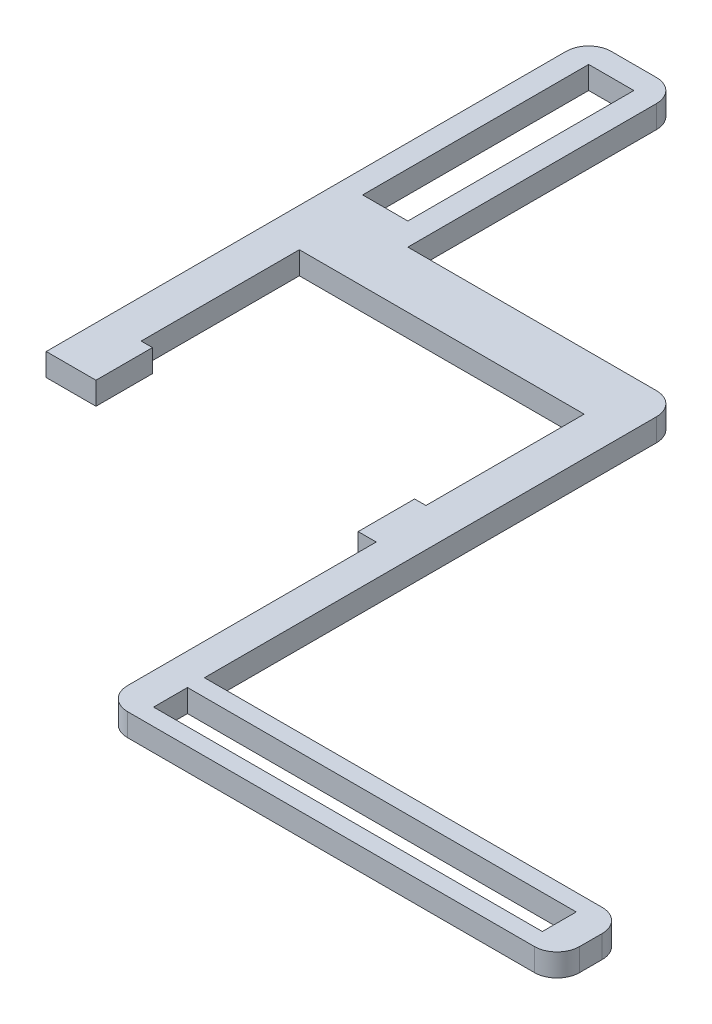
from build123d import *

# Parameters (mm, degrees)
BOSS_EXTRUDE1_DEPTH = 5
FILLET2_R           = 5
SKETCH2_W           = 86
SKETCH2_H           = 7.5
SKETCH2_W_2         = 10
SKETCH2_H_2         = 50
CUT_EXTRUDE1_DEPTH  = 161.667358228


with BuildPart() as part:
    # Sketch1 → Boss-Extrude1 (new body)
    with BuildSketch(Plane(origin=(0, 0, 0), x_dir=(1, 0, 0), z_dir=(0, 1, 0))):
        Polygon((-29, -17.5), (-31.5, -17.5), (-31.5, 17.5), (31.5, 17.5), (31.5, -17.5), (29, -17.5), (29, -30), (33, -30), (33, -90), (133, -90), (133, -75), (40, -75), (40, 30), (-20, 30), (-20, 90), (-40, 90), (-40, -30), (-29, -30), align=None)
    extrude(amount=BOSS_EXTRUDE1_DEPTH)

    # Fillet2
    fillet2_edges = [part.edges().sort_by_distance(p)[0] for p in [
        (-40, 2.5, -90),
        (-20, 2.5, -90),
        (40, 2.5, -30),
        (33, 2.5, 90),
        (133, 2.5, 90),
        (133, 2.5, 75),
    ]]
    fillet(fillet2_edges, radius=FILLET2_R)

    # Sketch2 → Cut-Extrude1 (cut, through all)
    with BuildSketch(Plane(origin=(0, 5, 0), x_dir=(1, 0, 0), z_dir=(0, 1, 0))):
        with Locations((83, -82.5)):
            Rectangle(SKETCH2_W, SKETCH2_H)
        with Locations((-30, 60)):
            Rectangle(SKETCH2_W_2, SKETCH2_H_2)
    extrude(amount=-CUT_EXTRUDE1_DEPTH, mode=Mode.SUBTRACT)


solid = part.part
